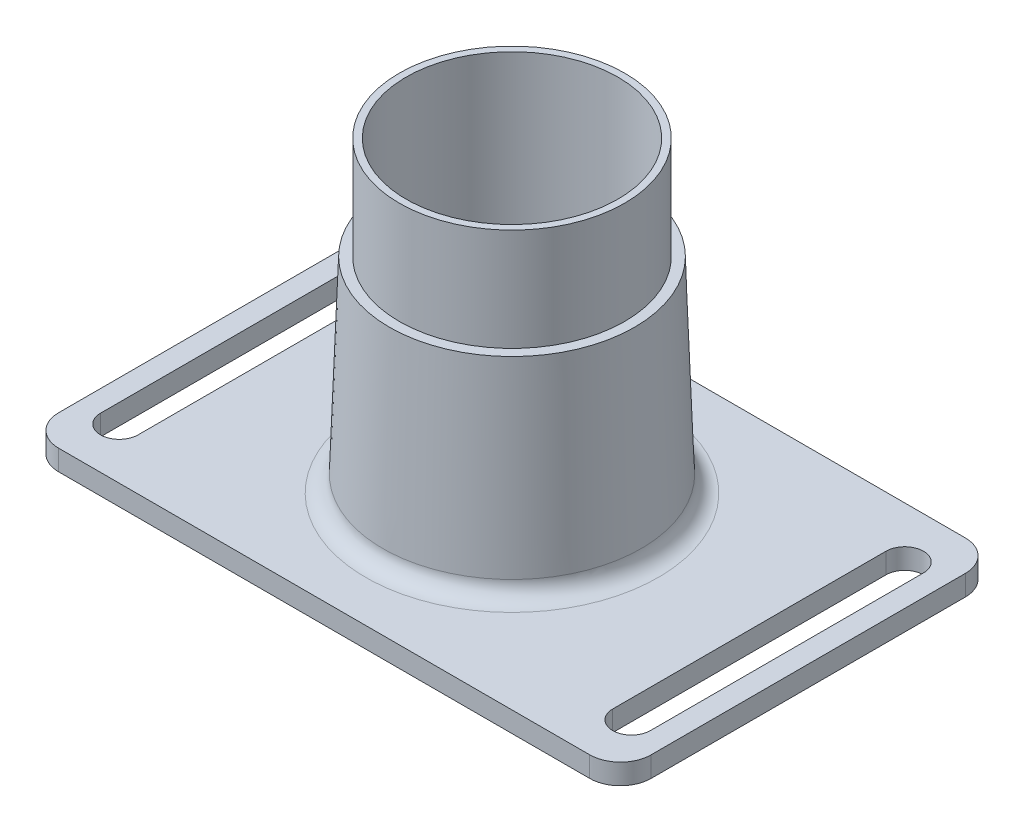
from build123d import *

# Parameters (mm, degrees)
SKETCH1_W           = 86.75
SKETCH1_H           = 55
SKETCH1_R           = 5.5
BOSS_EXTRUDE1_DEPTH = 3
FILLET1_R           = 4.5
SKETCH6_R           = 19
SKETCH6_R_2         = 15.5
BOSS_EXTRUDE3_DEPTH = 45
CUT_EXTRUDE1_REACH  = 71.284
CUT_EXTRUDE1_START  = -1
CUT_EXTRUDE3_REACH  = 63.046
SKETCH12_R          = 19
SKETCH12_R_2        = 16.5
DRAFT8_ANGLE        = 2
FILLET3_R           = 2.5


with BuildPart() as part:
    # Sketch1 → Boss-Extrude1 (new body)
    with BuildSketch(Plane(origin=(0, 0, 0), x_dir=(1, 0, 0), z_dir=(0, 1, 0))):
        Rectangle(SKETCH1_W, SKETCH1_H)
        with Locations(Location((0, 0, 0), (0, 0, 270))):
            Circle(SKETCH1_R, mode=Mode.SUBTRACT)
        with BuildLine():
            Line((-34.75, 20), (-34.75, -20))
            ThreePointArc((-34.75, -20), (-37.5, -22.75), (-40.25, -20))
            Line((-40.25, -20), (-40.25, 20))
            ThreePointArc((-40.25, 20), (-37.5, 22.75), (-34.75, 20))
        make_face(mode=Mode.SUBTRACT)
        with BuildLine():
            Line((40.25, 20), (40.25, -20))
            ThreePointArc((40.25, -20), (37.5, -22.75), (34.75, -20))
            Line((34.75, -20), (34.75, 20))
            ThreePointArc((34.75, 20), (37.5, 22.75), (40.25, 20))
        make_face(mode=Mode.SUBTRACT)
    extrude(amount=-BOSS_EXTRUDE1_DEPTH)

    # Fillet1
    fillet1_edges = [part.edges().sort_by_distance(p)[0] for p in [
        (-43.375, -1.5, -27.5),
        (43.375, -1.5, -27.5),
        (43.375, -1.5, 27.5),
        (-43.375, -1.5, 27.5),
    ]]
    fillet(fillet1_edges, radius=FILLET1_R)

    # Sketch6 → Boss-Extrude3 (add)
    with BuildSketch(Plane(origin=(0, 0, 0), x_dir=(1, 0, 0), z_dir=(0, 1, 0))):
        with Locations(Location((0, 0, 0), (0, 0, 90))):
            Circle(SKETCH6_R)
        with Locations(Location((0, 0, 0), (0, 0, 90))):
            Circle(SKETCH6_R_2, mode=Mode.SUBTRACT)
    extrude(amount=BOSS_EXTRUDE3_DEPTH)

    # Sketch9 → Cut-Extrude1 (cut, up to next)
    with BuildSketch(Plane(origin=(0, 0, 0), x_dir=(1, 0, 0), z_dir=(0, 1, 0)).offset(CUT_EXTRUDE1_START), mode=Mode.PRIVATE) as cut_extrude1_sk1:
        with BuildLine():
            Line((-31.75, -22.38), (-31.75, -1.5))
            Line((-31.75, -1.5), (-7.858116823, -1.5))
            ThreePointArc((-7.858116823, -1.5), (-7.587302584, -2.536304301), (-7.180478008, -3.527142694))
            Line((-7.180478008, -3.527142694), (-31.75, -22.38))
        make_face()
    cut_extrude1_tool1 = extrude(cut_extrude1_sk1.sketch, amount=-CUT_EXTRUDE1_REACH, mode=Mode.PRIVATE) & part.part
    # Sketch9 → Cut-Extrude1 (cut, up to next)
    with BuildSketch(Plane(origin=(0, 0, 0), x_dir=(1, 0, 0), z_dir=(0, 1, 0)).offset(CUT_EXTRUDE1_START), mode=Mode.PRIVATE) as cut_extrude1_sk2:
        with BuildLine():
            Line((-31.75, 22.38), (-7.180478008, 3.527142694))
            ThreePointArc((-7.180478008, 3.527142694), (-7.587302584, 2.536304301), (-7.858116823, 1.5))
            Line((-7.858116823, 1.5), (-31.75, 1.5))
            Line((-31.75, 1.5), (-31.75, 22.38))
        make_face()
    cut_extrude1_tool2 = extrude(cut_extrude1_sk2.sketch, amount=-CUT_EXTRUDE1_REACH, mode=Mode.PRIVATE) & part.part
    # Sketch9 → Cut-Extrude1 (cut, up to next)
    with BuildSketch(Plane(origin=(0, 0, 0), x_dir=(1, 0, 0), z_dir=(0, 1, 0)).offset(CUT_EXTRUDE1_START), mode=Mode.PRIVATE) as cut_extrude1_sk3:
        with BuildLine():
            Line((-29.63, -24.5), (-1.5, -24.5))
            Line((-1.5, -24.5), (-1.5, -7.858116823))
            ThreePointArc((-1.5, -7.858116823), (-3.584038711, -7.152249053), (-5.39695236, -5.905328545))
            Line((-5.39695236, -5.905328545), (-29.63, -24.5))
        make_face()
    cut_extrude1_tool3 = extrude(cut_extrude1_sk3.sketch, amount=-CUT_EXTRUDE1_REACH, mode=Mode.PRIVATE) & part.part
    # Sketch9 → Cut-Extrude1 (cut, up to next)
    with BuildSketch(Plane(origin=(0, 0, 0), x_dir=(1, 0, 0), z_dir=(0, 1, 0)).offset(CUT_EXTRUDE1_START), mode=Mode.PRIVATE) as cut_extrude1_sk4:
        with BuildLine():
            Line((29.63, -24.5), (5.39695236, -5.905328545))
            ThreePointArc((5.39695236, -5.905328545), (3.584038711, -7.152249053), (1.5, -7.858116823))
            Line((1.5, -7.858116823), (1.5, -24.5))
            Line((1.5, -24.5), (29.63, -24.5))
        make_face()
    cut_extrude1_tool4 = extrude(cut_extrude1_sk4.sketch, amount=-CUT_EXTRUDE1_REACH, mode=Mode.PRIVATE) & part.part
    # Sketch9 → Cut-Extrude1 (cut, up to next)
    with BuildSketch(Plane(origin=(0, 0, 0), x_dir=(1, 0, 0), z_dir=(0, 1, 0)).offset(CUT_EXTRUDE1_START), mode=Mode.PRIVATE) as cut_extrude1_sk5:
        with BuildLine():
            Line((1.5, 24.5), (1.5, 7.858116823))
            ThreePointArc((1.5, 7.858116823), (3.584038711, 7.152249053), (5.39695236, 5.905328545))
            Line((5.39695236, 5.905328545), (29.63, 24.5))
            Line((29.63, 24.5), (1.5, 24.5))
        make_face()
    cut_extrude1_tool5 = extrude(cut_extrude1_sk5.sketch, amount=-CUT_EXTRUDE1_REACH, mode=Mode.PRIVATE) & part.part
    # Sketch9 → Cut-Extrude1 (cut, up to next)
    with BuildSketch(Plane(origin=(0, 0, 0), x_dir=(1, 0, 0), z_dir=(0, 1, 0)).offset(CUT_EXTRUDE1_START), mode=Mode.PRIVATE) as cut_extrude1_sk6:
        with BuildLine():
            Line((-29.63, 24.5), (-5.39695236, 5.905328545))
            ThreePointArc((-5.39695236, 5.905328545), (-3.584038711, 7.152249053), (-1.5, 7.858116823))
            Line((-1.5, 7.858116823), (-1.5, 24.5))
            Line((-1.5, 24.5), (-29.63, 24.5))
        make_face()
    cut_extrude1_tool6 = extrude(cut_extrude1_sk6.sketch, amount=-CUT_EXTRUDE1_REACH, mode=Mode.PRIVATE) & part.part
    # Sketch9 → Cut-Extrude1 (cut, up to next)
    with BuildSketch(Plane(origin=(0, 0, 0), x_dir=(1, 0, 0), z_dir=(0, 1, 0)).offset(CUT_EXTRUDE1_START), mode=Mode.PRIVATE) as cut_extrude1_sk7:
        with BuildLine():
            Line((31.75, 1.5), (31.75, 22.38))
            Line((31.75, 22.38), (7.180478008, 3.527142694))
            ThreePointArc((7.180478008, 3.527142694), (7.587302584, 2.536304301), (7.858116823, 1.5))
            Line((7.858116823, 1.5), (31.75, 1.5))
        make_face()
    cut_extrude1_tool7 = extrude(cut_extrude1_sk7.sketch, amount=-CUT_EXTRUDE1_REACH, mode=Mode.PRIVATE) & part.part
    # Sketch9 → Cut-Extrude1 (cut, up to next)
    with BuildSketch(Plane(origin=(0, 0, 0), x_dir=(1, 0, 0), z_dir=(0, 1, 0)).offset(CUT_EXTRUDE1_START), mode=Mode.PRIVATE) as cut_extrude1_sk8:
        with BuildLine():
            Line((31.75, -22.38), (7.180478008, -3.527142694))
            ThreePointArc((7.180478008, -3.527142694), (7.587302584, -2.536304301), (7.858116823, -1.5))
            Line((7.858116823, -1.5), (31.75, -1.5))
            Line((31.75, -1.5), (31.75, -22.38))
        make_face()
    cut_extrude1_tool8 = extrude(cut_extrude1_sk8.sketch, amount=-CUT_EXTRUDE1_REACH, mode=Mode.PRIVATE) & part.part
    add(cut_extrude1_tool1.solids().sort_by_distance((-22.878744, -1, 8.53751))[0], mode=Mode.SUBTRACT)
    add(cut_extrude1_tool2.solids().sort_by_distance((-22.878744, -1, -8.53751))[0], mode=Mode.SUBTRACT)
    add(cut_extrude1_tool3.solids().sort_by_distance((-11.164331, -1, 17.722088))[0], mode=Mode.SUBTRACT)
    add(cut_extrude1_tool4.solids().sort_by_distance((11.164331, -1, 17.722088))[0], mode=Mode.SUBTRACT)
    add(cut_extrude1_tool5.solids().sort_by_distance((11.164331, -1, -17.722088))[0], mode=Mode.SUBTRACT)
    add(cut_extrude1_tool6.solids().sort_by_distance((-11.164331, -1, -17.722088))[0], mode=Mode.SUBTRACT)
    add(cut_extrude1_tool7.solids().sort_by_distance((22.878744, -1, -8.53751))[0], mode=Mode.SUBTRACT)
    add(cut_extrude1_tool8.solids().sort_by_distance((22.878744, -1, 8.53751))[0], mode=Mode.SUBTRACT)

    # Sketch12 → Cut-Extrude3 (cut, up to next)
    with BuildSketch(Plane(origin=(0, 30, 0), x_dir=(1, 0, 0), z_dir=(0, 1, 0)), mode=Mode.PRIVATE) as cut_extrude3_sk1:
        with Locations(Location((0, 0, 0), (0, 0, 90))):
            Circle(SKETCH12_R)
        with Locations(Location((0, 0, 0), (0, 0, 270))):
            Circle(SKETCH12_R_2, mode=Mode.SUBTRACT)
    cut_extrude3_tool1 = extrude(cut_extrude3_sk1.sketch, amount=CUT_EXTRUDE3_REACH, mode=Mode.PRIVATE) & part.part
    add(cut_extrude3_tool1.solids().sort_by_distance((0, 30, 18.462599))[0], mode=Mode.SUBTRACT)

    # Draft8
    draft8_faces = [part.faces().sort_by_distance(p)[0] for p in [
        (0, 15, 19),
    ]]
    draft(draft8_faces, Plane.ZX, DRAFT8_ANGLE)

    # Fillet3
    fillet3_edges = [part.edges().sort_by_distance(p)[0] for p in [
        (0, 0, 19),
    ]]
    fillet(fillet3_edges, radius=FILLET3_R)


solid = part.part
